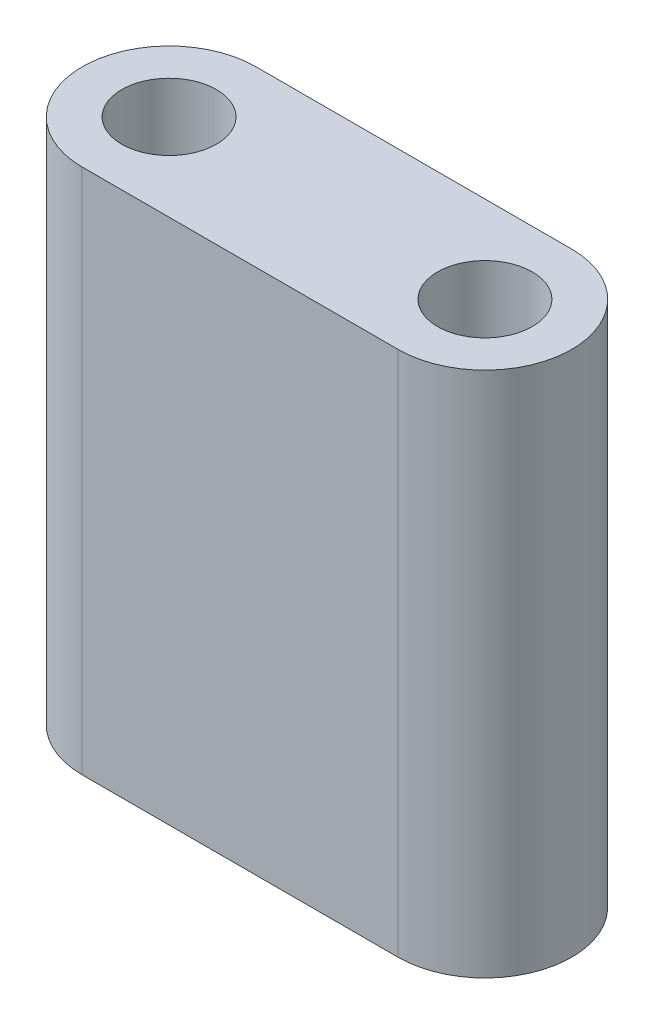
from build123d import *

# Parameters (mm, degrees)
SKETCH1_R           = 1.8
BOSS_EXTRUDE1_DEPTH = 20


with BuildPart() as part:
    # Sketch1 → Boss-Extrude1 (new body)
    with BuildSketch(Plane(origin=(0, 0, 0), x_dir=(1, 0, 0), z_dir=(0, 1, 0))):
        with BuildLine():
            Line((0, 3.3), (12, 3.3))
            ThreePointArc((12, 3.3), (15.3, 0), (12, -3.3))
            Line((12, -3.3), (0, -3.3))
            ThreePointArc((0, -3.3), (-3.3, 0), (0, 3.3))
        make_face()
        with Locations(Location((0, 0, 0), (0, 0, 270))):
            Circle(SKETCH1_R, mode=Mode.SUBTRACT)
        with Locations(Location((12, 0, 0), (0, 0, 90))):
            Circle(SKETCH1_R, mode=Mode.SUBTRACT)
    extrude(amount=BOSS_EXTRUDE1_DEPTH)


solid = part.part
